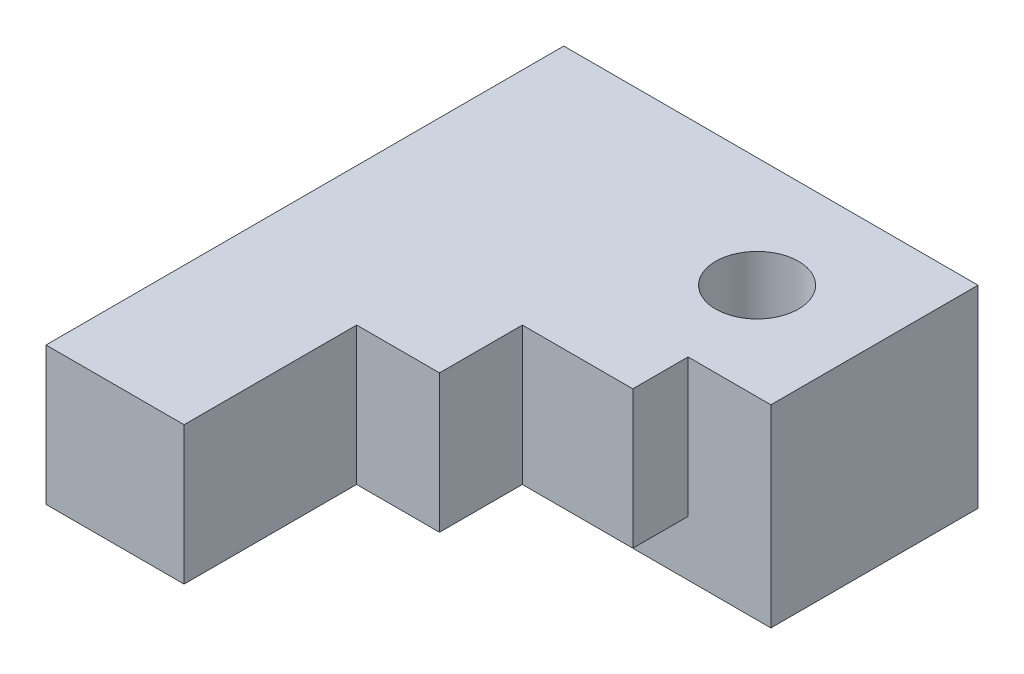
from build123d import *

# Parameters (mm, degrees)
BOSS_EXTRUDE1_DEPTH = 30
SKETCH3_3_W         = 20
SKETCH3_3_H         = 20
BOSS_EXTRUDE2_DEPTH = 75
SKETCH3_4_W         = 12
SKETCH3_4_H         = 20
BOSS_EXTRUDE3_DEPTH = 50
SKETCH3_5_W         = 16
SKETCH3_5_H         = 20
BOSS_EXTRUDE4_DEPTH = 38
SKETCH4_R           = 6
CUT_EXTRUDE1_DEPTH  = 101.04498988


with BuildPart() as part:
    # Sketch3 → Boss-Extrude1 (new body)
    with BuildSketch(Plane.XY):
        Polygon((20, -20), (0, -20), (0, -28), (60, -28), (60, 0), (48, 0), (48, -20), (32, -20), align=None)
    extrude(amount=BOSS_EXTRUDE1_DEPTH)

    # Sketch3<3> → Boss-Extrude2 (add)
    with BuildSketch(Plane.XY):
        with Locations((10, -10)):
            Rectangle(SKETCH3_3_W, SKETCH3_3_H)
    extrude(amount=BOSS_EXTRUDE2_DEPTH)

    # Sketch3<4> → Boss-Extrude3 (add)
    with BuildSketch(Plane.XY):
        with Locations((26, -10)):
            Rectangle(SKETCH3_4_W, SKETCH3_4_H)
    extrude(amount=BOSS_EXTRUDE3_DEPTH)

    # Sketch3<5> → Boss-Extrude4 (add)
    with BuildSketch(Plane.XY):
        with Locations((40, -10)):
            Rectangle(SKETCH3_5_W, SKETCH3_5_H)
    extrude(amount=BOSS_EXTRUDE4_DEPTH)

    # Sketch4 → Cut-Extrude1 (cut, through all)
    with BuildSketch(Plane.XZ.offset(28)):
        with Locations((44, 16)):
            Circle(SKETCH4_R)
    extrude(amount=-CUT_EXTRUDE1_DEPTH, mode=Mode.SUBTRACT)


solid = part.part
